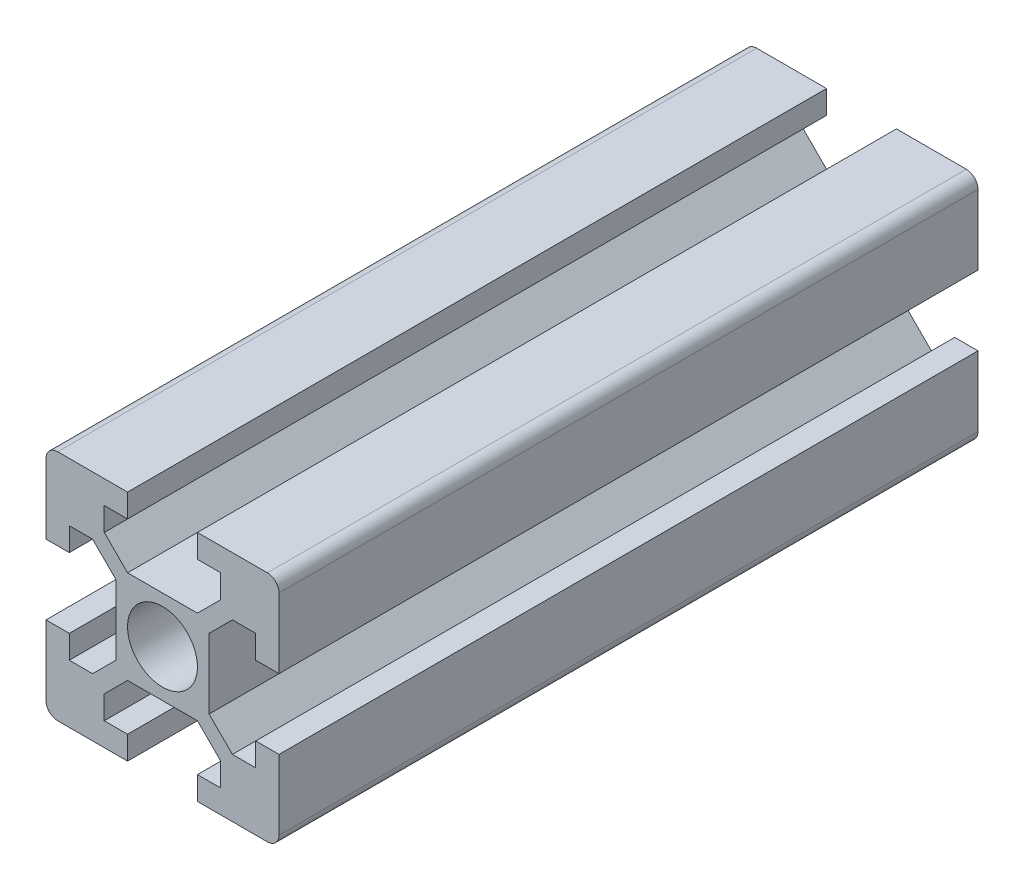
from build123d import *

# Parameters (mm, degrees)
SKETCH_1_W      = 8
SKETCH_1_H      = 8
SKETCH_1_R      = 3
EXTRUDE_1_DEPTH = 60
FILLET_2_R      = 1


with BuildPart() as part:
    # 草图1 → 凸台-拉伸1 (new body)
    # profile 1 of 6: a face of its own
    with BuildSketch(Plane.XY):
        Polygon((10, 11.431478203), (3, 11.431478203), (3, 9.431478203), (5, 9.431478203), (5, 7.431478203), (3, 5.431478203), (4, 5.431478203), (4, 4.431478203), (6, 6.431478203), (8, 6.431478203), (8, 4.431478203), (10, 4.431478203), align=None)
    # profile 2 of 6: a face of its own
    with BuildSketch(Plane.XY):
        Polygon((3, -6.568521797), (3, -8.568521797), (10, -8.568521797), (10, -1.568521797), (8, -1.568521797), (8, -3.568521797), (6, -3.568521797), (4, -1.568521797), (4, -2.568521797), (3, -2.568521797), (5, -4.568521797), (5, -6.568521797), align=None)
    # profile 3 of 6: a face of its own
    with BuildSketch(Plane.XY):
        Polygon((-8, -1.568521797), (-10, -1.568521797), (-10, -8.568521797), (-3, -8.568521797), (-3, -6.568521797), (-5, -6.568521797), (-5, -4.568521797), (-3, -2.568521797), (-4, -2.568521797), (-4, -1.568521797), (-6, -3.568521797), (-8, -3.568521797), align=None)
    # profile 4 of 6: a face of its own
    with BuildSketch(Plane.XY):
        Polygon((-3, 11.431478203), (-10, 11.431478203), (-4, 5.431478203), (-3, 5.431478203), (-5, 7.431478203), (-5, 9.431478203), (-3, 9.431478203), align=None)
    # profile 5 of 6: a face of its own
    with BuildSketch(Plane.XY):
        Polygon((-10, 11.431478203), (-10, 4.431478203), (-8, 4.431478203), (-8, 6.431478203), (-6, 6.431478203), (-4, 4.431478203), (-4, 5.431478203), align=None)
    # profile 6 of 6: a face of its own
    with BuildSketch(Plane.XY):
        with Locations((0, 1.431478203)):
            Rectangle(SKETCH_1_W, SKETCH_1_H)
        with Locations((0, 1.431478203)):
            Circle(SKETCH_1_R, mode=Mode.SUBTRACT)
    extrude(amount=EXTRUDE_1_DEPTH)

    # 圆角2
    fillet_2_edges = [part.edges().sort_by_distance(p)[0] for p in [
        (10, 11.431478203, 30),
        (10, -8.568521797, 30),
        (-10, -8.568521797, 30),
        (-10, 11.431478203, 30),
    ]]
    fillet(fillet_2_edges, radius=FILLET_2_R)


solid = part.part
